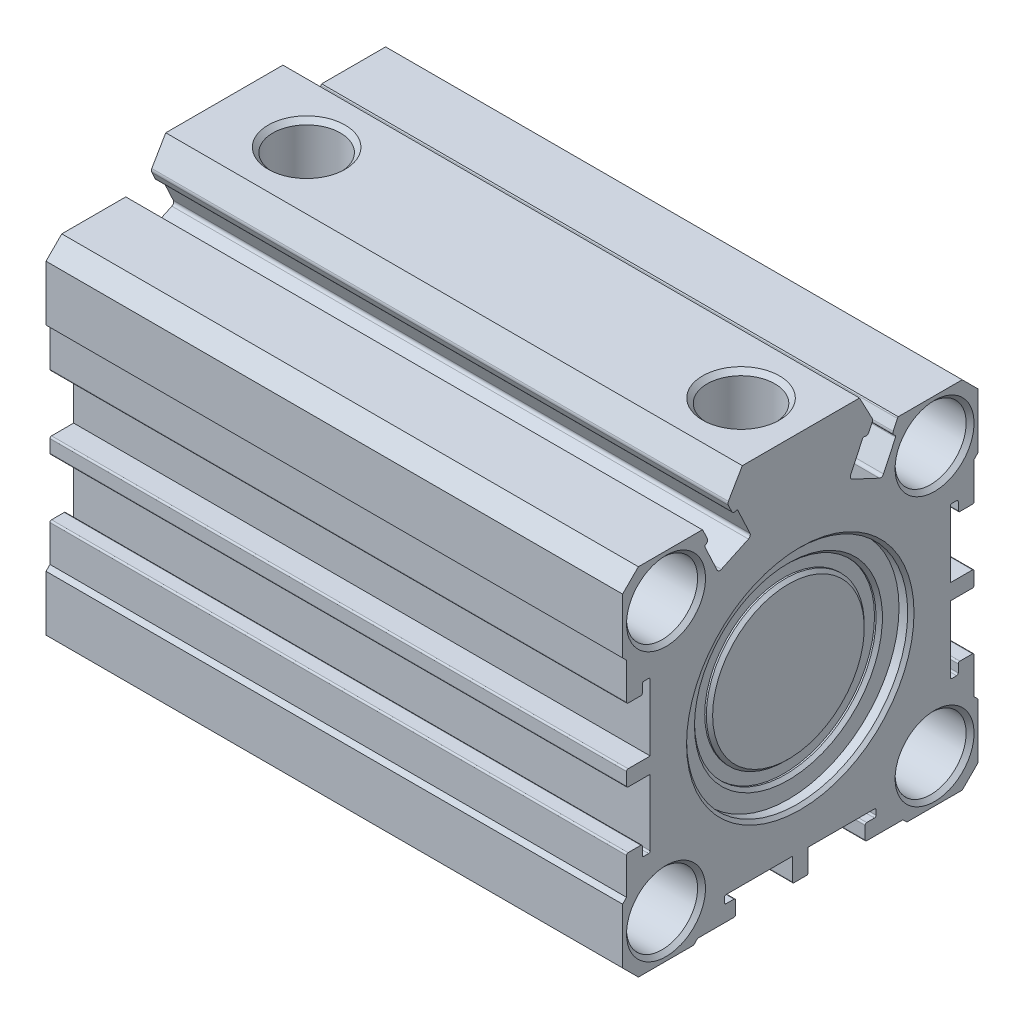
from build123d import *

# Parameters (mm, degrees)
EXTRUDE_1_DEPTH             = 73
PATTERN_LINEAR_1_COUNT      = 2
PATTERN_LINEAR_1_PITCH      = 34
PATTERN_LINEAR_1_COUNT_DIR2 = 2
PATTERN_LINEAR_1_PITCH_DIR2 = 34
PATTERN_LINEAR_2_COUNT      = 2
PATTERN_LINEAR_2_PITCH      = 34
PATTERN_LINEAR_2_COUNT_DIR2 = 2
PATTERN_LINEAR_2_PITCH_DIR2 = 34
HOLE_WIZARD_1_D             = 8.566
HOLE_WIZARD_1_DEPTH         = 8
HOLE_WIZARD_1_CSINK_D       = 9.728
HOLE_WIZARD_1_CSINK_ANGLE   = 90
HOLE_WIZARD_2_D             = 8.566
HOLE_WIZARD_2_DEPTH         = 8
HOLE_WIZARD_2_CSINK_D       = 9.728
HOLE_WIZARD_2_CSINK_ANGLE   = 90


with BuildPart() as part:
    # 草图1 → 凸台-拉伸1 (new body)
    with BuildSketch(Plane(origin=(0, 0, 0), x_dir=(0, 0, -1), z_dir=(1, 0, 0))):
        with BuildLine():
            Line((-22.5, -20.5), (-20.5, -22.5))
            Line((-20.5, -22.5), (-13.5, -22.5))
            Line((-13.5, -22.5), (-13, -22))
            Line((-13, -22), (-8.4, -22))
            ThreePointArc((-8.4, -22), (-8.258578644, -21.941421356), (-8.2, -21.8))
            Line((-8.2, -21.8), (-8.2, -20.2))
            ThreePointArc((-8.2, -20.2), (-8.258578644, -20.058578644), (-8.4, -20))
            Line((-8.4, -20), (-9.4, -20))
            ThreePointArc((-9.4, -20), (-9.541421356, -19.941421356), (-9.6, -19.8))
            Line((-9.6, -19.8), (-9.6, -19.2))
            ThreePointArc((-9.6, -19.2), (-9.541421356, -19.058578644), (-9.4, -19))
            Line((-9.4, -19), (-1, -19))
            Line((-1, -19), (-1, -21.8))
            ThreePointArc((-1, -21.8), (-0.941421356, -21.941421356), (-0.8, -22))
            Line((-0.8, -22), (0.8, -22))
            ThreePointArc((0.8, -22), (0.941421356, -21.941421356), (1, -21.8))
            Line((1, -21.8), (1, -19))
            Line((1, -19), (9.4, -19))
            ThreePointArc((9.4, -19), (9.541421356, -19.058578644), (9.6, -19.2))
            Line((9.6, -19.2), (9.6, -19.8))
            ThreePointArc((9.6, -19.8), (9.541421356, -19.941421356), (9.4, -20))
            Line((9.4, -20), (8.4, -20))
            ThreePointArc((8.4, -20), (8.258578644, -20.058578644), (8.2, -20.2))
            Line((8.2, -20.2), (8.2, -21.8))
            ThreePointArc((8.2, -21.8), (8.258578644, -21.941421356), (8.4, -22))
            Line((8.4, -22), (13, -22))
            Line((13, -22), (13.5, -22.5))
            Line((13.5, -22.5), (20.5, -22.5))
            Line((20.5, -22.5), (22.5, -20.5))
            Line((22.5, -20.5), (22.5, -13.5))
            Line((22.5, -13.5), (22, -13))
            Line((22, -13), (22, -8.4))
            ThreePointArc((22, -8.4), (21.941421356, -8.258578644), (21.8, -8.2))
            Line((21.8, -8.2), (20.2, -8.2))
            ThreePointArc((20.2, -8.2), (20.058578644, -8.258578644), (20, -8.4))
            Line((20, -8.4), (20, -9.4))
            ThreePointArc((20, -9.4), (19.941421356, -9.541421356), (19.8, -9.6))
            Line((19.8, -9.6), (19.2, -9.6))
            ThreePointArc((19.2, -9.6), (19.058578644, -9.541421356), (19, -9.4))
            Line((19, -9.4), (19, -1))
            Line((19, -1), (21.8, -1))
            ThreePointArc((21.8, -1), (21.941421356, -0.941421356), (22, -0.8))
            Line((22, -0.8), (22, 0.8))
            ThreePointArc((22, 0.8), (21.941421356, 0.941421356), (21.8, 1))
            Line((21.8, 1), (19, 1))
            Line((19, 1), (19, 9.4))
            ThreePointArc((19, 9.4), (19.058578644, 9.541421356), (19.2, 9.6))
            Line((19.2, 9.6), (19.8, 9.6))
            ThreePointArc((19.8, 9.6), (19.941421356, 9.541421356), (20, 9.4))
            Line((20, 9.4), (20, 8.4))
            ThreePointArc((20, 8.4), (20.058578644, 8.258578644), (20.2, 8.2))
            Line((20.2, 8.2), (21.8, 8.2))
            ThreePointArc((21.8, 8.2), (21.941421356, 8.258578644), (22, 8.4))
            Line((22, 8.4), (22, 13))
            Line((22, 13), (22.5, 13.5))
            Line((22.5, 13.5), (22.5, 20.5))
            Line((22.5, 20.5), (20.5, 22.5))
            Line((20.5, 22.5), (12.399074628, 22.5))
            ThreePointArc((12.399074628, 22.5), (12.345141117, 22.434736625), (12.302992156, 22.361309131))
            Line((12.302992156, 22.361309131), (11.768085172, 21.214197401))
            ThreePointArc((11.768085172, 21.214197401), (11.754731239, 20.908342039), (11.961560982, 20.682626982))
            ThreePointArc((11.961560982, 20.682626982), (12.064975854, 20.569769453), (12.058298887, 20.416841772))
            Line((12.058298887, 20.416841772), (10.536873145, 17.154133739))
            ThreePointArc((10.536873145, 17.154133739), (10.311158088, 16.947303995), (10.005302725, 16.960657929))
            Line((10.005302725, 16.960657929), (6.561333135, 18.566607323))
            ThreePointArc((6.561333135, 18.566607323), (6.354503391, 18.792322381), (6.367857325, 19.098177743))
            Line((6.367857325, 19.098177743), (7.889283067, 22.360885776))
            ThreePointArc((7.889283067, 22.360885776), (8.002140596, 22.464300648), (8.155068277, 22.457623681))
            ThreePointArc((8.155068277, 22.457623681), (8.460923639, 22.444269748), (8.686638696, 22.651099491))
            Line((8.686638696, 22.651099491), (9.102331568, 23.542555731))
            ThreePointArc((9.102331568, 23.542555731), (9.14902213, 23.766335638), (9.091230294, 23.987508782))
            Line((9.091230294, 23.987508782), (7.498998452, 27))
            Line((7.498998452, 27), (-7.337349681, 27))
            Line((-7.337349681, 27), (-9.105340307, 23.974365658))
            ThreePointArc((-9.105340307, 23.974365658), (-9.149027361, 23.758145812), (-9.102331568, 23.542555731))
            Line((-9.102331568, 23.542555731), (-8.686638696, 22.651099491))
            ThreePointArc((-8.686638696, 22.651099491), (-8.460923522, 22.444269705), (-8.155068051, 22.457623787))
            ThreePointArc((-8.155068051, 22.457623787), (-8.002140478, 22.464300605), (-7.889283067, 22.360885776))
            Line((-7.889283067, 22.360885776), (-6.367857325, 19.098177743))
            ThreePointArc((-6.367857325, 19.098177743), (-6.354503391, 18.792322381), (-6.561333135, 18.566607323))
            Line((-6.561333135, 18.566607323), (-10.005302725, 16.960657929))
            ThreePointArc((-10.005302725, 16.960657929), (-10.311158088, 16.947303995), (-10.536873145, 17.154133739))
            Line((-10.536873145, 17.154133739), (-12.058298887, 20.416841772))
            ThreePointArc((-12.058298887, 20.416841772), (-12.064975854, 20.569769453), (-11.961560982, 20.682626982))
            ThreePointArc((-11.961560982, 20.682626982), (-11.754731239, 20.908342039), (-11.768085172, 21.214197401))
            Line((-11.768085172, 21.214197401), (-12.302992156, 22.361309131))
            ThreePointArc((-12.302992156, 22.361309131), (-12.345141117, 22.434736625), (-12.399074628, 22.5))
            Line((-12.399074628, 22.5), (-20.5, 22.5))
            Line((-20.5, 22.5), (-22.5, 20.5))
            Line((-22.5, 20.5), (-22.5, 13.5))
            Line((-22.5, 13.5), (-22, 13))
            Line((-22, 13), (-22, 8.4))
            ThreePointArc((-22, 8.4), (-21.941421356, 8.258578644), (-21.8, 8.2))
            Line((-21.8, 8.2), (-20.2, 8.2))
            ThreePointArc((-20.2, 8.2), (-20.058578644, 8.258578644), (-20, 8.4))
            Line((-20, 8.4), (-20, 9.4))
            ThreePointArc((-20, 9.4), (-19.941421356, 9.541421356), (-19.8, 9.6))
            Line((-19.8, 9.6), (-19.2, 9.6))
            ThreePointArc((-19.2, 9.6), (-19.058578644, 9.541421356), (-19, 9.4))
            Line((-19, 9.4), (-19, 1))
            Line((-19, 1), (-21.8, 1))
            ThreePointArc((-21.8, 1), (-21.941421356, 0.941421356), (-22, 0.8))
            Line((-22, 0.8), (-22, -0.8))
            ThreePointArc((-22, -0.8), (-21.941421356, -0.941421356), (-21.8, -1))
            Line((-21.8, -1), (-19, -1))
            Line((-19, -1), (-19, -9.4))
            ThreePointArc((-19, -9.4), (-19.058578644, -9.541421356), (-19.2, -9.6))
            Line((-19.2, -9.6), (-19.8, -9.6))
            ThreePointArc((-19.8, -9.6), (-19.941421356, -9.541421356), (-20, -9.4))
            Line((-20, -9.4), (-20, -8.4))
            ThreePointArc((-20, -8.4), (-20.058578644, -8.258578644), (-20.2, -8.2))
            Line((-20.2, -8.2), (-21.8, -8.2))
            ThreePointArc((-21.8, -8.2), (-21.941421356, -8.258578644), (-22, -8.4))
            Line((-22, -8.4), (-22, -13))
            Line((-22, -13), (-22.5, -13.5))
            Line((-22.5, -13.5), (-22.5, -20.5))
        make_face()
    extrude(amount=EXTRUDE_1_DEPTH)

    # 草图2 → 切除-旋转1 (revolve, cut)
    with BuildSketch(Plane.XY.offset(17)):
        Polygon((0, -17), (0, -12), (0.5, -12.5), (7, -12.5), (7, -14), (7.5415, -14.5415), (36.5, -14.5415), (36.5, -17), align=None)
    cut_revolve_1 = revolve(axis=Axis((36.5, -17, 17), (-1, 0, 0)), mode=Mode.SUBTRACT)

    # 阵列(线性)1: Cut-Revolve 1 2 × 2
    with Locations(*[(0, j * PATTERN_LINEAR_1_PITCH_DIR2, -i * PATTERN_LINEAR_1_PITCH) for i in range(PATTERN_LINEAR_1_COUNT) for j in range(PATTERN_LINEAR_1_COUNT_DIR2) if (i, j) != (0, 0)]):
        add(cut_revolve_1, mode=Mode.SUBTRACT)

    # 草图4 → 切除-旋转2 (revolve, cut)
    with BuildSketch(Plane.XY.offset(17)):
        Polygon((36.5, -17), (36.5, -14.5415), (65.4585, -14.5415), (66, -14), (66, -12.5), (72.5, -12.5), (73, -12), (73, -17), align=None)
    cut_revolve_2 = revolve(axis=Axis((73, -17, 17), (-1, 0, 0)), mode=Mode.SUBTRACT)

    # 阵列(线性)2: Cut-Revolve 2 2 × 2
    with Locations(*[(0, j * PATTERN_LINEAR_2_PITCH_DIR2, -i * PATTERN_LINEAR_2_PITCH) for i in range(PATTERN_LINEAR_2_COUNT) for j in range(PATTERN_LINEAR_2_COUNT_DIR2) if (i, j) != (0, 0)]):
        add(cut_revolve_2, mode=Mode.SUBTRACT)

    # 草图6 → 切除-旋转3 (revolve, cut)
    with BuildSketch(Plane.XY):
        Polygon((0, 0), (0, 8), (10.5, 8), (10.5, 16), (68.5, 16), (68.5, 0), align=None)
    revolve(axis=Axis((68.5, 0, 0), (-1, 0, 0)), mode=Mode.SUBTRACT)

    # 草图7 → 切除-旋转4 (revolve, cut)
    with BuildSketch(Plane.XY):
        Polygon((0, 0), (0, 17.4), (0.4, 17), (3.1, 17), (3.1, 0), align=None)
    revolve(axis=Axis((3.1, 0, 0), (-1, 0, 0)), mode=Mode.SUBTRACT)

    # 孔1
    with Locations(Plane(origin=(0, 27, 0), x_dir=(1, 0, 0), z_dir=(0, 1, 0))):
        with Locations((10.5, 0)):
            CounterSinkHole(HOLE_WIZARD_1_D / 2, HOLE_WIZARD_1_CSINK_D / 2, depth=HOLE_WIZARD_1_DEPTH, counter_sink_angle=HOLE_WIZARD_1_CSINK_ANGLE)

    # 孔2
    with Locations(Plane(origin=(0, 27, 0), x_dir=(1, 0, 0), z_dir=(0, 1, 0))):
        with Locations((65.5, 0)):
            CounterSinkHole(HOLE_WIZARD_2_D / 2, HOLE_WIZARD_2_CSINK_D / 2, depth=HOLE_WIZARD_2_DEPTH, counter_sink_angle=HOLE_WIZARD_2_CSINK_ANGLE)

    # 草图12 → 旋转1 (revolve)
    with BuildSketch(Plane.XY):
        with BuildLine():
            Line((0.6, 8), (3.1, 8))
            Line((3.1, 8), (3.1, 11.5))
            Line((3.1, 11.5), (1.1, 11.5))
            ThreePointArc((1.1, 11.5), (0.746446609, 11.353553391), (0.6, 11))
            Line((0.6, 11), (0.6, 8))
        make_face()
    revolve(axis=Axis((3.1, 0, 0), (-1, 0, 0)))

    # 草图13 → 孔3 (revolve, cut)
    with BuildSketch(Plane(origin=(73, 0, 0), x_dir=(0, 0, -1), z_dir=(0, 1, 0))):
        Polygon((0, 0), (0, 1.5), (14, 1.5), (14, 0.4), (14.4, 0), align=None)
    revolve(axis=Axis((79.445314094, 0, 0), (-1, 0, 0)), mode=Mode.SUBTRACT)

    # 草图15 → 切除-旋转5 (revolve, cut)
    with BuildSketch(Plane.XY):
        Polygon((70.9, 11.5), (70.9, 10), (71.1, 10), (71.5, 9.6), (71.5, 11.9), (71.1, 11.5), align=None)
    revolve(axis=Axis((50, 0, 0), (-1, 0, 0)), mode=Mode.SUBTRACT)


solid = part.part
